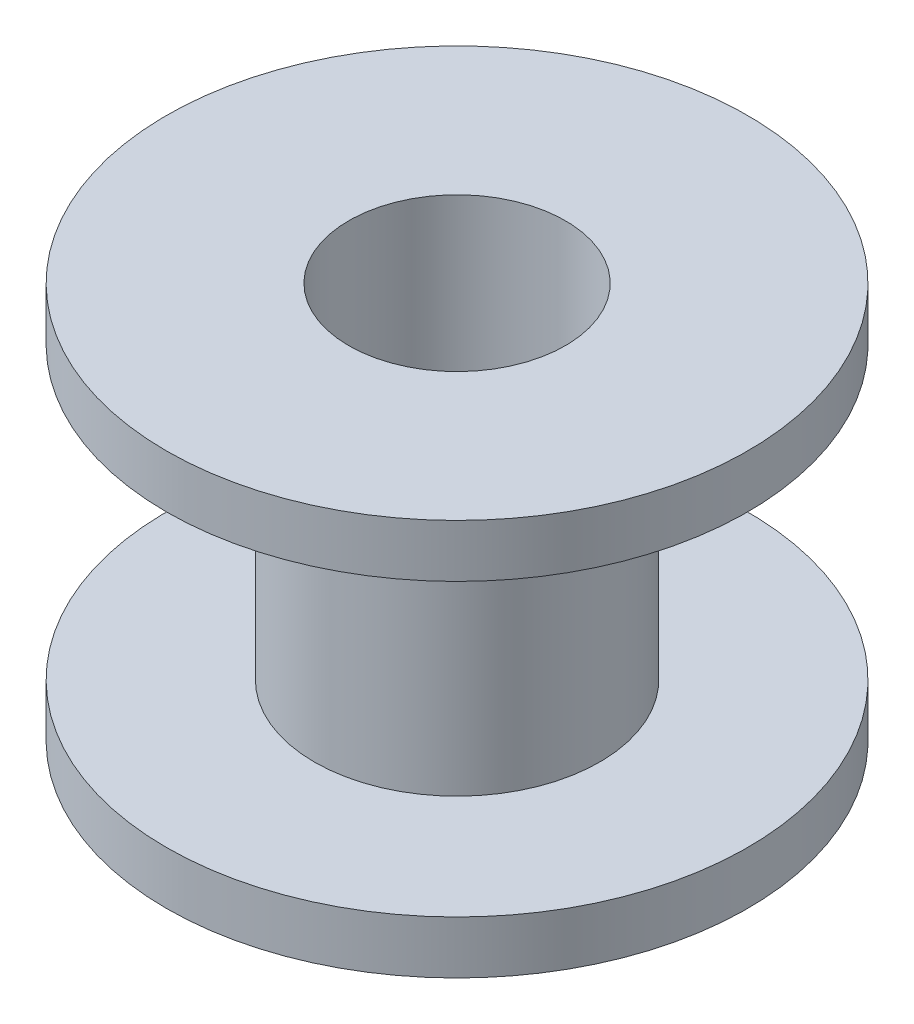
from build123d import *


with BuildPart() as part:
    # Sketch1 → Revolve1 (revolve)
    with BuildSketch(Plane(origin=(0, 0, 0), x_dir=(0, 0, -1), z_dir=(1, 0, 0))):
        Polygon((-5.4, 5.5), (-5.4, -5.5), (-11, -5.5), (-11, -7.5), (-4.1, -7.5), (-4.1, 7.5), (-11, 7.5), (-11, 5.5), align=None)
    revolve(axis=Axis((0, 44.659090909, 0), (0, -1, 0)))


solid = part.part
